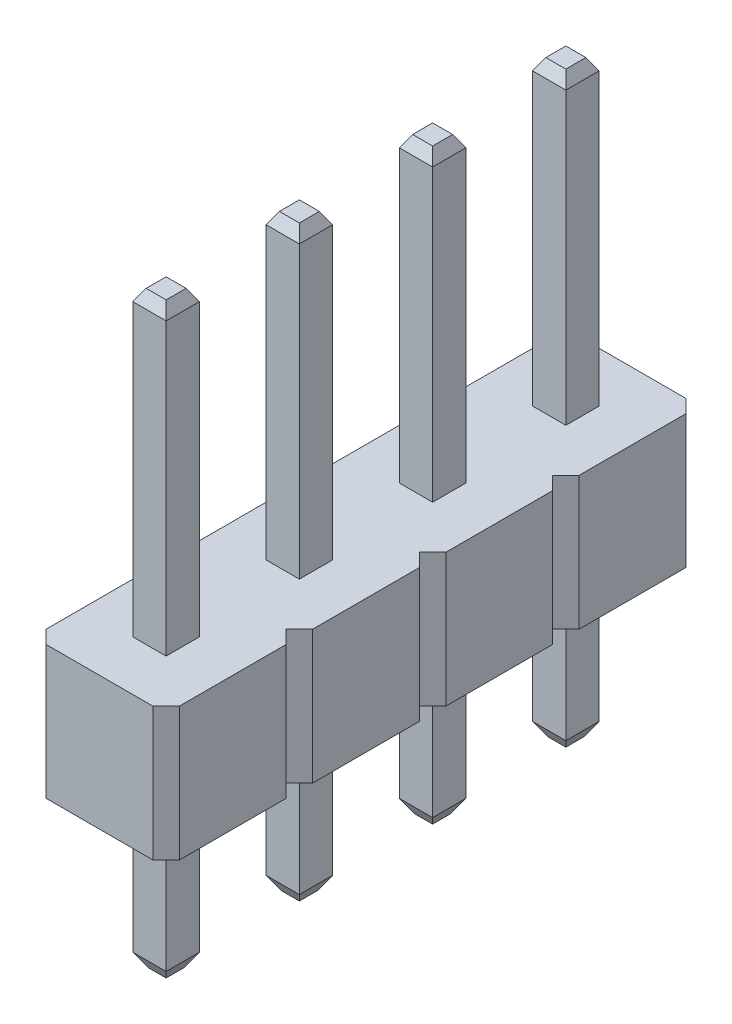
from build123d import *
from OCP.BRepFilletAPI import BRepFilletAPI_MakeChamfer

# Parameters (mm, degrees)
BOSS_EXTRUDE1_DEPTH         = 2.54
SKETCH3_W                   = 0.635
SKETCH3_H                   = 0.635
CHAMFER1_SIZE               = 0.254
CHAMFER1_SIZE2              = 0.146646968
CHAMFER2_SIZE               = 0.127
CHAMFER2_SIZE2              = 0.219970453
LPATTERN1_COUNT             = 4
LPATTERN1_PITCH             = 2.54
CHAMFER1_OF_LPATTERN1_SIZE  = 0.254
CHAMFER1_OF_LPATTERN1_SIZE2 = 0.146646968
CHAMFER2_OF_LPATTERN1_SIZE2 = 0.127
CHAMFER2_OF_LPATTERN1_SIZE  = 0.219970453


with BuildPart() as part:
    # Sketch1 → Boss-Extrude1 (new body)
    with BuildSketch(Plane(origin=(0, 0, 0), x_dir=(1, 0, 0), z_dir=(0, 1, 0))):
        Polygon((1.016, 1.27), (1.27, 1.016), (1.27, -1.016), (1.016, -1.27), (-1.016, -1.27), (-1.27, -1.016), (-1.27, 1.016), (-1.016, 1.27), align=None)
    boss_extrude1 = extrude(amount=BOSS_EXTRUDE1_DEPTH)

    # Sweep1: sweep along a path in Sketch2
    with BuildLine(Plane.XY) as sweep1_path:
        Line((0, -2.921), (0, 0))
        Line((0, 0), (0, 8.2931))
    # Sketch3 → Sweep1 (sweep)
    with BuildSketch(Plane(origin=(0, -2.921, 0), x_dir=(-1, 0, 0), z_dir=(0, -1, 0))):
        Rectangle(SKETCH3_W, SKETCH3_H)
    sweep1 = sweep(path=sweep1_path.line)

    # Chamfer1: one chamfer whose edges measure the first distance from different faces: ONE call of the kernel's chamfer builder (chamfer() names one face for all edges)
    chamfer1_edges_1 = [part.edges().sort_by_distance(p)[0] for p in [
        (0.3175, -2.921, 0),
    ]]
    chamfer1_side_1 = [part.faces().sort_by_distance(p)[0] for p in [
        (0.3175, -1.4605, 0),
    ]]
    chamfer1_edges_2 = [part.edges().sort_by_distance(p)[0] for p in [
        (0, -2.921, 0.3175),
    ]]
    chamfer1_side_2 = [part.faces().sort_by_distance(p)[0] for p in [
        (0, -1.4605, 0.3175),
    ]]
    chamfer1_edges_3 = [part.edges().sort_by_distance(p)[0] for p in [
        (-0.3175, -2.921, 0),
    ]]
    chamfer1_side_3 = [part.faces().sort_by_distance(p)[0] for p in [
        (-0.3175, -1.4605, 0),
    ]]
    chamfer1_edges_4 = [part.edges().sort_by_distance(p)[0] for p in [
        (0, -2.921, -0.3175),
    ]]
    chamfer1_side_4 = [part.faces().sort_by_distance(p)[0] for p in [
        (0, -1.4605, -0.3175),
    ]]
    chamfer1 = BRepFilletAPI_MakeChamfer(part.part.solid().wrapped)
    for e in chamfer1_edges_1:
        chamfer1.Add(CHAMFER1_SIZE, CHAMFER1_SIZE2, e.wrapped, chamfer1_side_1[0].wrapped)  # the first distance lies on this face
    for e in chamfer1_edges_2:
        chamfer1.Add(CHAMFER1_SIZE, CHAMFER1_SIZE2, e.wrapped, chamfer1_side_2[0].wrapped)  # the first distance lies on this face
    for e in chamfer1_edges_3:
        chamfer1.Add(CHAMFER1_SIZE, CHAMFER1_SIZE2, e.wrapped, chamfer1_side_3[0].wrapped)  # the first distance lies on this face
    for e in chamfer1_edges_4:
        chamfer1.Add(CHAMFER1_SIZE, CHAMFER1_SIZE2, e.wrapped, chamfer1_side_4[0].wrapped)  # the first distance lies on this face
    add(Compound.cast(chamfer1.Shape()), mode=Mode.REPLACE)

    # Chamfer2
    chamfer2_edges = [part.edges().sort_by_distance(p)[0] for p in [
        (0.3175, 8.2931, 0),
        (0, 8.2931, 0.3175),
        (-0.3175, 8.2931, 0),
        (0, 8.2931, -0.3175),
    ]]
    chamfer2_side = [part.faces().sort_by_distance(p)[0] for p in [
        (0, 8.2931, 0),
    ]]
    chamfer(chamfer2_edges, length=CHAMFER2_SIZE, length2=CHAMFER2_SIZE2, reference=chamfer2_side[0])

    # LPattern1: Boss-Extrude1, Sweep1 ×4
    with Locations(*[(0, 0, i * LPATTERN1_PITCH) for i in range(1, LPATTERN1_COUNT)]):
        add(boss_extrude1)
        add(sweep1)

    # Chamfer1 of LPattern1: one chamfer whose edges measure the first distance from different faces: ONE call of the kernel's chamfer builder (chamfer() names one face for all edges)
    chamfer1_of_lpattern1_edges_1 = [part.edges().sort_by_distance(p)[0] for p in [
        (0.3175, -2.921, 2.54),
    ]]
    chamfer1_of_lpattern1_side_1 = [part.faces().sort_by_distance(p)[0] for p in [
        (0.3175, -1.4605, 2.54),
    ]]
    chamfer1_of_lpattern1_edges_2 = [part.edges().sort_by_distance(p)[0] for p in [
        (0, -2.921, 2.8575),
    ]]
    chamfer1_of_lpattern1_side_2 = [part.faces().sort_by_distance(p)[0] for p in [
        (0, -1.4605, 2.8575),
    ]]
    chamfer1_of_lpattern1_edges_3 = [part.edges().sort_by_distance(p)[0] for p in [
        (-0.3175, -2.921, 2.54),
    ]]
    chamfer1_of_lpattern1_side_3 = [part.faces().sort_by_distance(p)[0] for p in [
        (-0.3175, -1.4605, 2.54),
    ]]
    chamfer1_of_lpattern1_edges_4 = [part.edges().sort_by_distance(p)[0] for p in [
        (0, -2.921, 2.2225),
    ]]
    chamfer1_of_lpattern1_side_4 = [part.faces().sort_by_distance(p)[0] for p in [
        (0, -1.4605, 2.2225),
    ]]
    chamfer1_of_lpattern1_edges_5 = [part.edges().sort_by_distance(p)[0] for p in [
        (0.3175, -2.921, 5.08),
    ]]
    chamfer1_of_lpattern1_side_5 = [part.faces().sort_by_distance(p)[0] for p in [
        (0.3175, -1.4605, 5.08),
    ]]
    chamfer1_of_lpattern1_edges_6 = [part.edges().sort_by_distance(p)[0] for p in [
        (0, -2.921, 5.3975),
    ]]
    chamfer1_of_lpattern1_side_6 = [part.faces().sort_by_distance(p)[0] for p in [
        (0, -1.4605, 5.3975),
    ]]
    chamfer1_of_lpattern1_edges_7 = [part.edges().sort_by_distance(p)[0] for p in [
        (-0.3175, -2.921, 5.08),
    ]]
    chamfer1_of_lpattern1_side_7 = [part.faces().sort_by_distance(p)[0] for p in [
        (-0.3175, -1.4605, 5.08),
    ]]
    chamfer1_of_lpattern1_edges_8 = [part.edges().sort_by_distance(p)[0] for p in [
        (0, -2.921, 4.7625),
    ]]
    chamfer1_of_lpattern1_side_8 = [part.faces().sort_by_distance(p)[0] for p in [
        (0, -1.4605, 4.7625),
    ]]
    chamfer1_of_lpattern1_edges_9 = [part.edges().sort_by_distance(p)[0] for p in [
        (0.3175, -2.921, 7.62),
    ]]
    chamfer1_of_lpattern1_side_9 = [part.faces().sort_by_distance(p)[0] for p in [
        (0.3175, -1.4605, 7.62),
    ]]
    chamfer1_of_lpattern1_edges_10 = [part.edges().sort_by_distance(p)[0] for p in [
        (0, -2.921, 7.9375),
    ]]
    chamfer1_of_lpattern1_side_10 = [part.faces().sort_by_distance(p)[0] for p in [
        (0, -1.4605, 7.9375),
    ]]
    chamfer1_of_lpattern1_edges_11 = [part.edges().sort_by_distance(p)[0] for p in [
        (-0.3175, -2.921, 7.62),
    ]]
    chamfer1_of_lpattern1_side_11 = [part.faces().sort_by_distance(p)[0] for p in [
        (-0.3175, -1.4605, 7.62),
    ]]
    chamfer1_of_lpattern1_edges_12 = [part.edges().sort_by_distance(p)[0] for p in [
        (0, -2.921, 7.3025),
    ]]
    chamfer1_of_lpattern1_side_12 = [part.faces().sort_by_distance(p)[0] for p in [
        (0, -1.4605, 7.3025),
    ]]
    chamfer1_of_lpattern1 = BRepFilletAPI_MakeChamfer(part.part.solid().wrapped)
    for e in chamfer1_of_lpattern1_edges_1:
        chamfer1_of_lpattern1.Add(CHAMFER1_OF_LPATTERN1_SIZE, CHAMFER1_OF_LPATTERN1_SIZE2, e.wrapped, chamfer1_of_lpattern1_side_1[0].wrapped)  # the first distance lies on this face
    for e in chamfer1_of_lpattern1_edges_2:
        chamfer1_of_lpattern1.Add(CHAMFER1_OF_LPATTERN1_SIZE, CHAMFER1_OF_LPATTERN1_SIZE2, e.wrapped, chamfer1_of_lpattern1_side_2[0].wrapped)  # the first distance lies on this face
    for e in chamfer1_of_lpattern1_edges_3:
        chamfer1_of_lpattern1.Add(CHAMFER1_OF_LPATTERN1_SIZE, CHAMFER1_OF_LPATTERN1_SIZE2, e.wrapped, chamfer1_of_lpattern1_side_3[0].wrapped)  # the first distance lies on this face
    for e in chamfer1_of_lpattern1_edges_4:
        chamfer1_of_lpattern1.Add(CHAMFER1_OF_LPATTERN1_SIZE, CHAMFER1_OF_LPATTERN1_SIZE2, e.wrapped, chamfer1_of_lpattern1_side_4[0].wrapped)  # the first distance lies on this face
    for e in chamfer1_of_lpattern1_edges_5:
        chamfer1_of_lpattern1.Add(CHAMFER1_OF_LPATTERN1_SIZE, CHAMFER1_OF_LPATTERN1_SIZE2, e.wrapped, chamfer1_of_lpattern1_side_5[0].wrapped)  # the first distance lies on this face
    for e in chamfer1_of_lpattern1_edges_6:
        chamfer1_of_lpattern1.Add(CHAMFER1_OF_LPATTERN1_SIZE, CHAMFER1_OF_LPATTERN1_SIZE2, e.wrapped, chamfer1_of_lpattern1_side_6[0].wrapped)  # the first distance lies on this face
    for e in chamfer1_of_lpattern1_edges_7:
        chamfer1_of_lpattern1.Add(CHAMFER1_OF_LPATTERN1_SIZE, CHAMFER1_OF_LPATTERN1_SIZE2, e.wrapped, chamfer1_of_lpattern1_side_7[0].wrapped)  # the first distance lies on this face
    for e in chamfer1_of_lpattern1_edges_8:
        chamfer1_of_lpattern1.Add(CHAMFER1_OF_LPATTERN1_SIZE, CHAMFER1_OF_LPATTERN1_SIZE2, e.wrapped, chamfer1_of_lpattern1_side_8[0].wrapped)  # the first distance lies on this face
    for e in chamfer1_of_lpattern1_edges_9:
        chamfer1_of_lpattern1.Add(CHAMFER1_OF_LPATTERN1_SIZE, CHAMFER1_OF_LPATTERN1_SIZE2, e.wrapped, chamfer1_of_lpattern1_side_9[0].wrapped)  # the first distance lies on this face
    for e in chamfer1_of_lpattern1_edges_10:
        chamfer1_of_lpattern1.Add(CHAMFER1_OF_LPATTERN1_SIZE, CHAMFER1_OF_LPATTERN1_SIZE2, e.wrapped, chamfer1_of_lpattern1_side_10[0].wrapped)  # the first distance lies on this face
    for e in chamfer1_of_lpattern1_edges_11:
        chamfer1_of_lpattern1.Add(CHAMFER1_OF_LPATTERN1_SIZE, CHAMFER1_OF_LPATTERN1_SIZE2, e.wrapped, chamfer1_of_lpattern1_side_11[0].wrapped)  # the first distance lies on this face
    for e in chamfer1_of_lpattern1_edges_12:
        chamfer1_of_lpattern1.Add(CHAMFER1_OF_LPATTERN1_SIZE, CHAMFER1_OF_LPATTERN1_SIZE2, e.wrapped, chamfer1_of_lpattern1_side_12[0].wrapped)  # the first distance lies on this face
    add(Compound.cast(chamfer1_of_lpattern1.Shape()), mode=Mode.REPLACE)

    # Chamfer2 of LPattern1
    chamfer2_of_lpattern1_edges = [part.edges().sort_by_distance(p)[0] for p in [
        (0.3175, 8.2931, 2.54),
        (0, 8.2931, 2.8575),
        (-0.3175, 8.2931, 2.54),
        (0, 8.2931, 2.2225),
        (0.3175, 8.2931, 5.08),
        (0, 8.2931, 5.3975),
        (-0.3175, 8.2931, 5.08),
        (0, 8.2931, 4.7625),
        (0.3175, 8.2931, 7.62),
        (0, 8.2931, 7.9375),
        (-0.3175, 8.2931, 7.62),
        (0, 8.2931, 7.3025),
    ]]
    chamfer(chamfer2_of_lpattern1_edges, length=CHAMFER2_OF_LPATTERN1_SIZE, length2=CHAMFER2_OF_LPATTERN1_SIZE2)


solid = part.part
